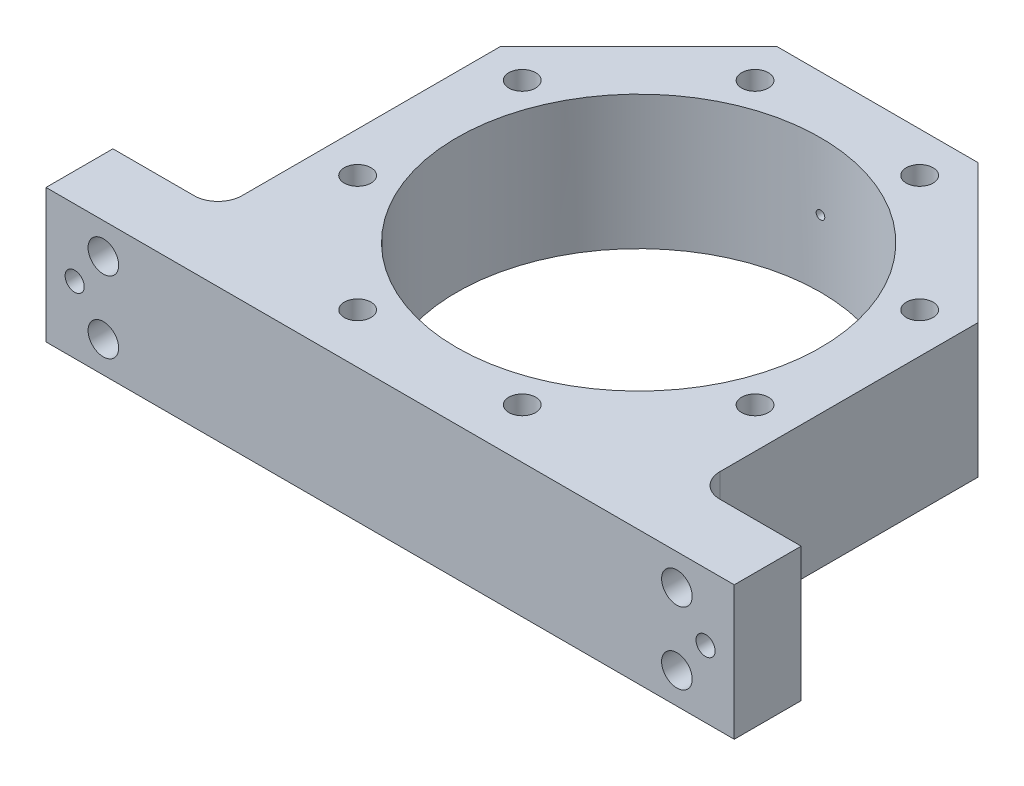
from build123d import *

# Parameters (mm, degrees)
EXTRUDE_1_DEPTH             = 140
CUT_EXTRUDE_1_REACH         = 641.766
SKETCH_2_R                  = 190.25
SKETCH_3_R                  = 14
CUT_EXTRUDE_2_DEPTH         = 35
PATTERN_CIRCULAR_1_COUNT    = 8
MIRROR_1_COPY_1_SKETCH_R    = 14
MIRROR_1_COPY_1_DEPTH       = 35
MIRROR_1_COPY_2_SKETCH_R    = 14
MIRROR_1_COPY_2_DEPTH       = 35
MIRROR_1_COPY_3_SKETCH_R    = 14
MIRROR_1_COPY_3_DEPTH       = 35
MIRROR_1_COPY_4_SKETCH_R    = 14
MIRROR_1_COPY_4_DEPTH       = 35
MIRROR_1_COPY_5_SKETCH_R    = 14
MIRROR_1_COPY_5_DEPTH       = 35
MIRROR_1_COPY_6_SKETCH_R    = 14
MIRROR_1_COPY_6_DEPTH       = 35
MIRROR_1_COPY_7_SKETCH_R    = 14
MIRROR_1_COPY_7_DEPTH       = 35
MIRROR_1_COPY_8_SKETCH_R    = 14
MIRROR_1_COPY_8_DEPTH       = 35
SKETCH_4_R                  = 4.25
CUT_EXTRUDE_3_DEPTH         = 15
CUT_EXTRUDE_4_REACH         = 656.766
CUT_EXTRUDE_START           = -15
SKETCH_6_R                  = 4.5
CUT_EXTRUDE_5_REACH         = 587.491
SKETCH_7_R                  = 16
SKETCH_8_R                  = 24
CUT_EXTRUDE_6_DEPTH         = 30
PATTERN_LINEAR_1_COUNT      = 2
PATTERN_LINEAR_1_PITCH      = 600
PATTERN_LINEAR_1_COUNT_DIR2 = 2
PATTERN_LINEAR_1_PITCH_DIR2 = 75
CUT_EXTRUDE_7_REACH         = 587.491
SKETCH_7_3_R                = 10
PATTERN_LINEAR_2_COUNT      = 2
PATTERN_LINEAR_2_PITCH      = 660
FILLET_1_R                  = 25


with BuildPart() as part:
    # 草图1 → 凸台-拉伸1 (new body)
    with BuildSketch(Plane(origin=(0, 0, 0), x_dir=(1, 0, 0), z_dir=(0, 1, 0))):
        Polygon((360, 0), (-360, 0), (-360, 70), (-250, 70), (-250, 365), (-105, 510), (105, 510), (250, 365), (250, 70), (360, 70), align=None)
    extrude(amount=EXTRUDE_1_DEPTH)

    # 草图2 → 切除-拉伸1 (cut, up to next)
    with BuildSketch(Plane(origin=(0, 140, 0), x_dir=(1, 0, 0), z_dir=(0, 1, 0)), mode=Mode.PRIVATE) as cut_extrude_1_sk1:
        with Locations((0, 260)):
            Circle(SKETCH_2_R)
    cut_extrude_1_tool1 = extrude(cut_extrude_1_sk1.sketch, amount=-CUT_EXTRUDE_1_REACH, mode=Mode.PRIVATE) & part.part
    add(cut_extrude_1_tool1.solids().sort_by_distance((0, 140, -260))[0], mode=Mode.SUBTRACT)

    # 草图3 → 切除-拉伸2 (cut)
    with BuildSketch(Plane(origin=(0, 140, 0), x_dir=(1, 0, 0), z_dir=(0, 1, 0))):
        with Locations((-86.103772282, 467.872894815)):
            Circle(SKETCH_3_R)
    cut_extrude_2 = extrude(amount=-CUT_EXTRUDE_2_DEPTH, mode=Mode.SUBTRACT)

    # 阵列(圆周)1: 切除-拉伸2 ×8 about axis
    pattern_circular_1_axis = Axis((0, -0.001, -260), (0, 1, 0))
    for i in range(1, PATTERN_CIRCULAR_1_COUNT):
        add(cut_extrude_2.rotate(pattern_circular_1_axis, i * 360 / PATTERN_CIRCULAR_1_COUNT), mode=Mode.SUBTRACT)

    # 镜向1 copy 1 sketch → 镜向1 copy 1 (cut)
    with BuildSketch(Plane(origin=(183.847763109, 0, -76.152236891), x_dir=(0.7071067811865476, 0, -0.7071067811865475), z_dir=(0, -1, 0))):
        with Locations((-86.103772282, -467.872894815)):
            Circle(MIRROR_1_COPY_1_SKETCH_R)
    extrude(amount=-MIRROR_1_COPY_1_DEPTH, mode=Mode.SUBTRACT)

    # 镜向1 copy 2 sketch → 镜向1 copy 2 (cut)
    with BuildSketch(Plane(origin=(260, 0, -260), x_dir=(0, 0, -1), z_dir=(0, -1, 0))):
        with Locations((-86.103772282, -467.872894815)):
            Circle(MIRROR_1_COPY_2_SKETCH_R)
    extrude(amount=-MIRROR_1_COPY_2_DEPTH, mode=Mode.SUBTRACT)

    # 镜向1 copy 3 sketch → 镜向1 copy 3 (cut)
    with BuildSketch(Plane(origin=(183.847763109, 0, -443.847763109), x_dir=(-0.7071067811865475, 0, -0.7071067811865476), z_dir=(0, -1, 0))):
        with Locations((-86.103772282, -467.872894815)):
            Circle(MIRROR_1_COPY_3_SKETCH_R)
    extrude(amount=-MIRROR_1_COPY_3_DEPTH, mode=Mode.SUBTRACT)

    # 镜向1 copy 4 sketch → 镜向1 copy 4 (cut)
    with BuildSketch(Plane(origin=(0, 0, -520), x_dir=(-1, 0, 0), z_dir=(0, -1, 0))):
        with Locations((-86.103772282, -467.872894815)):
            Circle(MIRROR_1_COPY_4_SKETCH_R)
    extrude(amount=-MIRROR_1_COPY_4_DEPTH, mode=Mode.SUBTRACT)

    # 镜向1 copy 5 sketch → 镜向1 copy 5 (cut)
    with BuildSketch(Plane(origin=(-183.847763109, 0, -443.847763109), x_dir=(-0.7071067811865477, 0, 0.7071067811865475), z_dir=(0, -1, 0))):
        with Locations((-86.103772282, -467.872894815)):
            Circle(MIRROR_1_COPY_5_SKETCH_R)
    extrude(amount=-MIRROR_1_COPY_5_DEPTH, mode=Mode.SUBTRACT)

    # 镜向1 copy 6 sketch → 镜向1 copy 6 (cut)
    with BuildSketch(Plane(origin=(-260, 0, -260), x_dir=(0, 0, 1), z_dir=(0, -1, 0))):
        with Locations((-86.103772282, -467.872894815)):
            Circle(MIRROR_1_COPY_6_SKETCH_R)
    extrude(amount=-MIRROR_1_COPY_6_DEPTH, mode=Mode.SUBTRACT)

    # 镜向1 copy 7 sketch → 镜向1 copy 7 (cut)
    with BuildSketch(Plane(origin=(-183.847763109, 0, -76.152236891), x_dir=(0.7071067811865474, 0, 0.7071067811865477), z_dir=(0, -1, 0))):
        with Locations((-86.103772282, -467.872894815)):
            Circle(MIRROR_1_COPY_7_SKETCH_R)
    extrude(amount=-MIRROR_1_COPY_7_DEPTH, mode=Mode.SUBTRACT)

    # 镜向1 copy 8 sketch → 镜向1 copy 8 (cut)
    with BuildSketch(Plane.XZ):
        with Locations((-86.103772282, -467.872894815)):
            Circle(MIRROR_1_COPY_8_SKETCH_R)
    extrude(amount=-MIRROR_1_COPY_8_DEPTH, mode=Mode.SUBTRACT)

    # 草图4 → 切除-拉伸3 (cut)
    with BuildSketch(Plane(origin=(0, 0, -510), x_dir=(-1, 0, 0), z_dir=(0, 0, -1))):
        with Locations((0, 70)):
            Circle(SKETCH_4_R)
    extrude(amount=-CUT_EXTRUDE_3_DEPTH, mode=Mode.SUBTRACT)

    # 草图6 → 切除-拉伸4 (cut, up to next)
    with BuildSketch(Plane(origin=(0, 0, -510), x_dir=(-1, 0, 0), z_dir=(0, 0, -1)).offset(CUT_EXTRUDE_START), mode=Mode.PRIVATE) as cut_extrude_4_sk1:
        with Locations((0, 70)):
            Circle(SKETCH_6_R)
    cut_extrude_4_tool1 = extrude(cut_extrude_4_sk1.sketch, amount=-CUT_EXTRUDE_4_REACH, mode=Mode.PRIVATE) & part.part
    add(cut_extrude_4_tool1.solids().sort_by_distance((0, 70, -495))[0], mode=Mode.SUBTRACT)

    # 草图7 → 切除-拉伸5 (cut, up to next)
    with BuildSketch(Plane(origin=(0, 0, -70), x_dir=(-1, 0, 0), z_dir=(0, 0, -1)), mode=Mode.PRIVATE) as cut_extrude_5_sk1:
        with Locations((-300, 107.5)):
            Circle(SKETCH_7_R)
    cut_extrude_5_tool1 = extrude(cut_extrude_5_sk1.sketch, amount=-CUT_EXTRUDE_5_REACH, mode=Mode.PRIVATE) & part.part
    cut_extrude_5 = cut_extrude_5_tool1.solids().sort_by_distance((300, 107.5, -70))[0]
    add(cut_extrude_5, mode=Mode.SUBTRACT)

    # 草图8 → 切除-拉伸6 (cut)
    with BuildSketch(Plane(origin=(0, 0, -70), x_dir=(-1, 0, 0), z_dir=(0, 0, -1))):
        with Locations((-300, 107.5)):
            Circle(SKETCH_8_R)
    cut_extrude_6 = extrude(amount=-CUT_EXTRUDE_6_DEPTH, mode=Mode.SUBTRACT)

    # 阵列(线性)1: 切除-拉伸5, Cut-Extrude 6 2 × 2
    with Locations(*[(-i * PATTERN_LINEAR_1_PITCH, -j * PATTERN_LINEAR_1_PITCH_DIR2, 0) for i in range(PATTERN_LINEAR_1_COUNT) for j in range(PATTERN_LINEAR_1_COUNT_DIR2) if (i, j) != (0, 0)]):
        add(cut_extrude_5, mode=Mode.SUBTRACT)
        add(cut_extrude_6, mode=Mode.SUBTRACT)

    # 草图7<3> → 切除-拉伸7 (cut, up to next)
    with BuildSketch(Plane(origin=(0, 0, -70), x_dir=(-1, 0, 0), z_dir=(0, 0, -1)), mode=Mode.PRIVATE) as cut_extrude_7_sk1:
        with Locations((-330, 70)):
            Circle(SKETCH_7_3_R)
    cut_extrude_7_tool1 = extrude(cut_extrude_7_sk1.sketch, amount=-CUT_EXTRUDE_7_REACH, mode=Mode.PRIVATE) & part.part
    cut_extrude_7 = cut_extrude_7_tool1.solids().sort_by_distance((330, 70, -70))[0]
    add(cut_extrude_7, mode=Mode.SUBTRACT)

    # 阵列(线性)2: 切除-拉伸7 ×2
    with Locations(*[(-i * PATTERN_LINEAR_2_PITCH, 0, 0) for i in range(1, PATTERN_LINEAR_2_COUNT)]):
        add(cut_extrude_7, mode=Mode.SUBTRACT)

    # 圆角1
    fillet_1_edges = [part.edges().sort_by_distance(p)[0] for p in [
        (-250, 70, -70),
        (250, 70, -70),
    ]]
    fillet(fillet_1_edges, radius=FILLET_1_R)


solid = part.part
